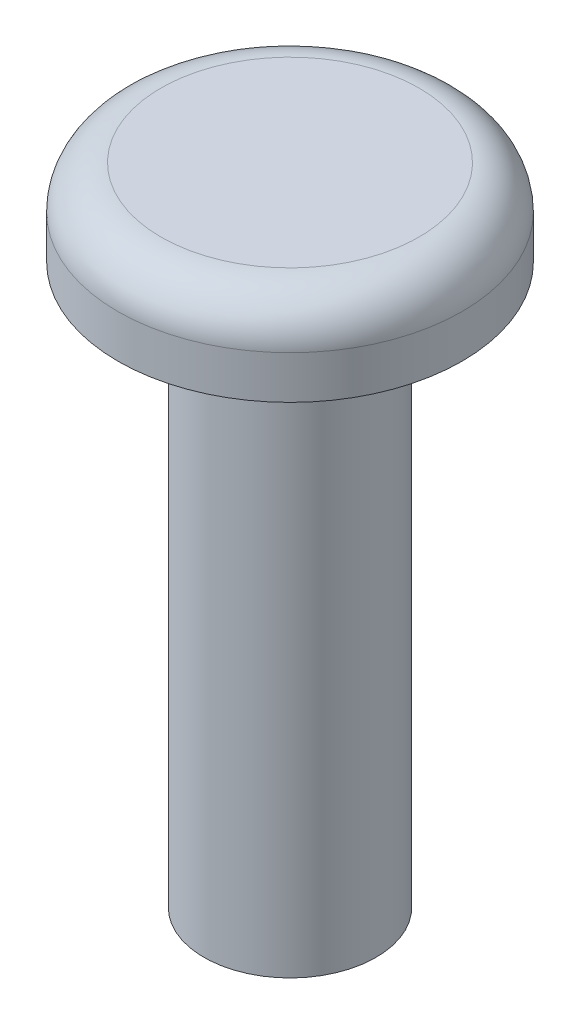
from build123d import *

# Parameters (mm, degrees)
SKETCH1_R           = 20
BOSS_EXTRUDE1_DEPTH = 10
SKETCH2_R           = 10
BOSS_EXTRUDE2_DEPTH = 65
FILLET1_R           = 5


with BuildPart() as part:
    # Sketch1 → Boss-Extrude1 (new body)
    with BuildSketch(Plane(origin=(0, 0, 0), x_dir=(1, 0, 0), z_dir=(0, 1, 0))):
        with Locations(Location((0, 0, 0), (0, 0, 270))):
            Circle(SKETCH1_R)
    extrude(amount=BOSS_EXTRUDE1_DEPTH)

    # Sketch2 → Boss-Extrude2 (add)
    with BuildSketch(Plane.XZ):
        with Locations(Location((0, 0, 0), (0, 0, 270))):
            Circle(SKETCH2_R)
    extrude(amount=BOSS_EXTRUDE2_DEPTH)

    # Fillet1
    fillet1_edges = [part.edges().sort_by_distance(p)[0] for p in [
        (0, 10, -20),
    ]]
    fillet(fillet1_edges, radius=FILLET1_R)


solid = part.part
